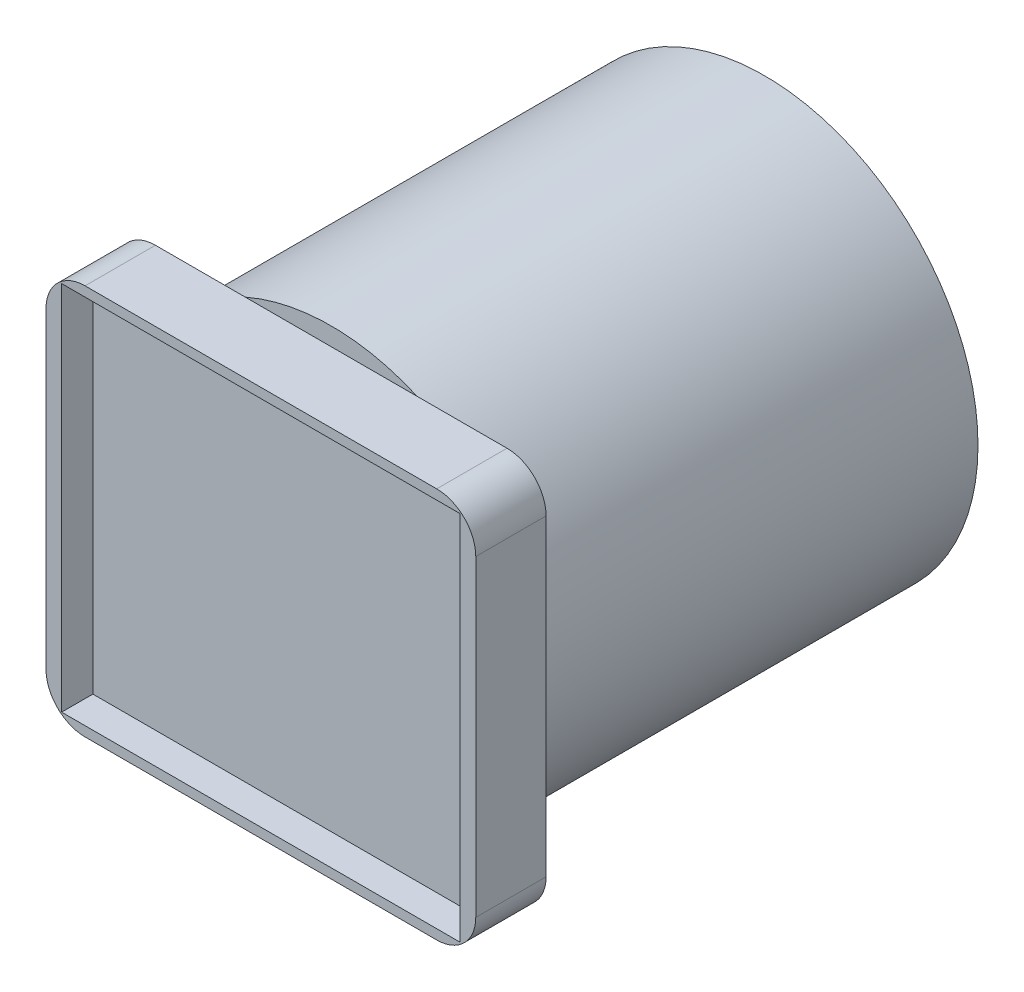
from build123d import *

# Parameters (mm, degrees)
SKETCH2_W           = 27.94
SKETCH2_H           = 25.4
SKETCH2_W_2         = 25.908
SKETCH2_H_2         = 24.13
BOSS_EXTRUDE1_DEPTH = 2.032
SKETCH3_W           = 27.94
SKETCH3_H           = 25.4
BOSS_EXTRUDE2_DEPTH = 2.54
SKETCH4_R           = 13.87475
BOSS_EXTRUDE3_DEPTH = 28.175
FILLET1_R           = 2.54


with BuildPart() as part:
    # Sketch2 → Boss-Extrude1 (new body)
    with BuildSketch(Plane.XY):
        Rectangle(SKETCH2_W, SKETCH2_H)
        Rectangle(SKETCH2_W_2, SKETCH2_H_2, mode=Mode.SUBTRACT)
    extrude(amount=BOSS_EXTRUDE1_DEPTH)

    # Sketch3 → Boss-Extrude2 (add)
    with BuildSketch(Plane(origin=(0, 0, 0), x_dir=(-1, 0, 0), z_dir=(0, 0, -1))):
        Rectangle(SKETCH3_W, SKETCH3_H)
    extrude(amount=BOSS_EXTRUDE2_DEPTH)

    # Sketch4 → Boss-Extrude3 (add)
    with BuildSketch(Plane(origin=(0, 0, -2.54), x_dir=(-1, 0, 0), z_dir=(0, 0, -1))):
        with Locations(Location((0, 0, 0), (0, 0, 246.252892173))):
            Circle(SKETCH4_R)
    extrude(amount=BOSS_EXTRUDE3_DEPTH)

    # Fillet1
    fillet1_edges = [part.edges().sort_by_distance(p)[0] for p in [
        (-13.97, 12.7, -0.254),
        (13.97, 12.7, -0.254),
        (13.97, -12.7, -0.254),
        (-13.97, -12.7, -0.254),
    ]]
    fillet(fillet1_edges, radius=FILLET1_R)


solid = part.part
